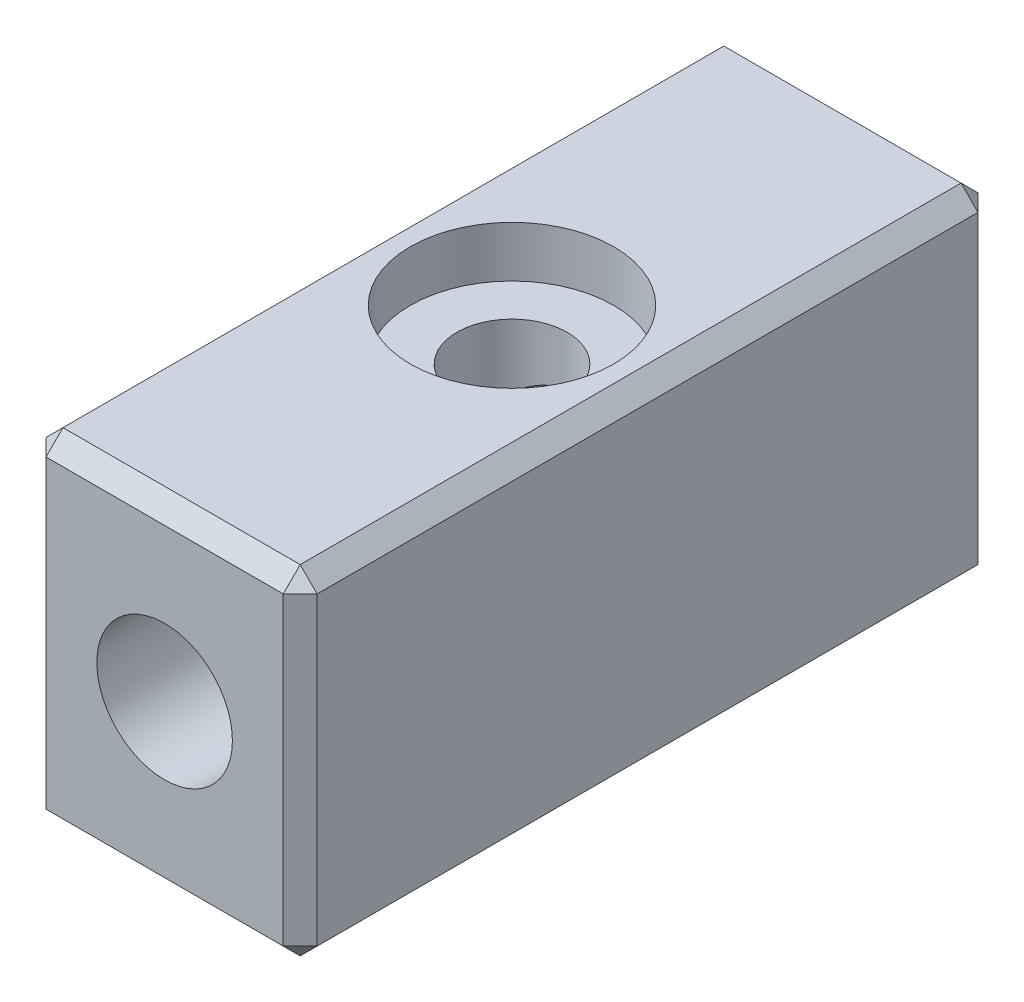
from build123d import *

# Parameters (mm, degrees)
SKETCH1_W           = 8
SKETCH1_H           = 10
BOSS_EXTRUDE1_DEPTH = 20.5
SKETCH1_3_R         = 2
CUT_EXTRUDE1_DEPTH  = 23
SKETCH2_R           = 1.625
CUT_EXTRUDE3_DEPTH  = 12
CHAMFER1_SIZE       = 0.5
SKETCH3_R           = 3
CUT_EXTRUDE4_DEPTH  = 1.5


with BuildPart() as part:
    # Sketch1 → Boss-Extrude1 (new body)
    with BuildSketch(Plane.XY):
        Rectangle(SKETCH1_W, SKETCH1_H)
    extrude(amount=BOSS_EXTRUDE1_DEPTH)

    # Sketch1<3> → Cut-Extrude1 (cut)
    with BuildSketch(Plane.XY):
        Circle(SKETCH1_3_R)
    extrude(amount=CUT_EXTRUDE1_DEPTH, mode=Mode.SUBTRACT)

    # Sketch2 → Cut-Extrude3 (cut)
    with BuildSketch(Plane(origin=(0, 5, 0), x_dir=(1, 0, 0), z_dir=(0, 1, 0))):
        with Locations((0, -10.25)):
            Circle(SKETCH2_R)
    extrude(amount=-CUT_EXTRUDE3_DEPTH, mode=Mode.SUBTRACT)

    # Chamfer1
    chamfer1_edges = [part.edges().sort_by_distance(p)[0] for p in [
        (-4, 5, 10.25),
        (-4, 0, 20.5),
        (-4, -5, 10.25),
        (-4, 0, 0),
        (4, -5, 10.25),
        (0, -5, 20.5),
        (4, 0, 20.5),
        (0, -5, 0),
        (4, 0, 0),
        (0, 5, 0),
        (4, 5, 10.25),
        (0, 5, 20.5),
    ]]
    chamfer(chamfer1_edges, length=CHAMFER1_SIZE)

    # Sketch3 → Cut-Extrude4 (cut)
    with BuildSketch(Plane(origin=(0, 5, 0), x_dir=(1, 0, 0), z_dir=(0, 1, 0))):
        with Locations((0, -10.25)):
            Circle(SKETCH3_R)
    extrude(amount=-CUT_EXTRUDE4_DEPTH, mode=Mode.SUBTRACT)


solid = part.part
